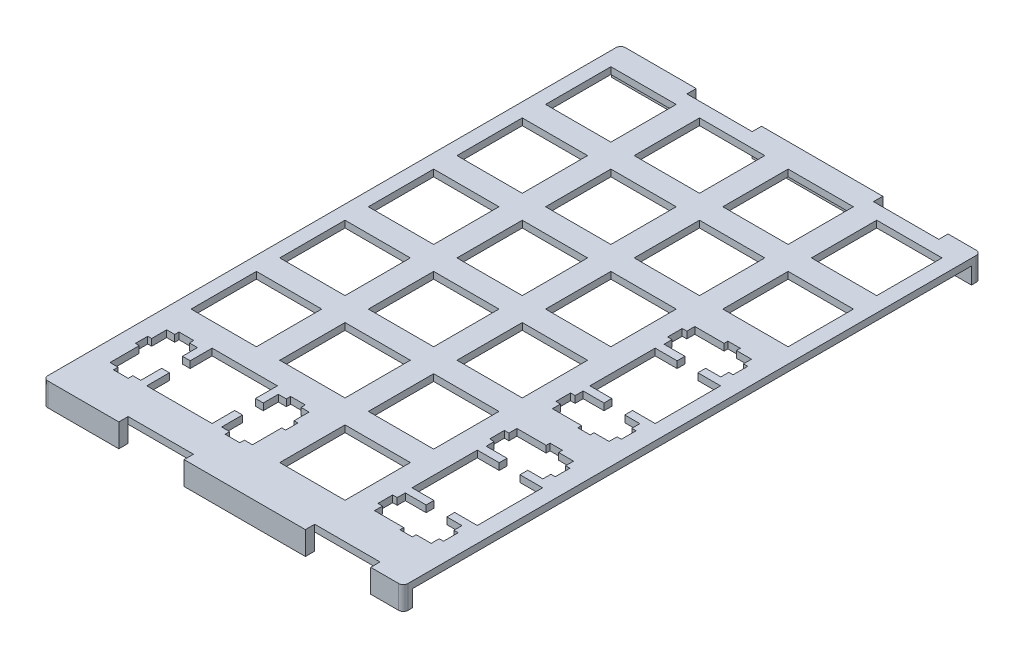
from build123d import *

# Parameters (mm, degrees)
SKETCH_1_W          = 14
SKETCH_1_H          = 14
EXTRUDE_1_DEPTH     = 1.45
SKETCH_2_W          = 16.2
SKETCH_2_H          = 2
SKETCH_2_W_2        = 26
SKETCH_2_W_3        = 7
EXTRUDE_2_DEPTH     = 3.55
FILLET_1_R          = 1
CUT_EXTRUDE_1_DEPTH = 164.601986541


with BuildPart() as part:
    # 草图1 → 凸台-拉伸1 (new body)
    with BuildSketch(Plane(origin=(0, 0, 0), x_dir=(1, 0, 0), z_dir=(0, 1, 0))):
        Polygon((109, 1.9), (109, -121.9), (102, -121.9), (102, -119.9), (88, -119.9), (88, -121.9), (62, -121.9), (62, -119.9), (48, -119.9), (48, -121.9), (31.8, -121.9), (31.8, 1.9), (48, 1.9), (48, -0.1), (62, -0.1), (62, 1.9), (88, 1.9), (88, -0.1), (102, -0.1), (102, 1.9), align=None)
        with Locations((41.8, -10.2)):
            Rectangle(SKETCH_1_W, SKETCH_1_H, mode=Mode.SUBTRACT)
        with Locations((60.8, -10.2)):
            Rectangle(SKETCH_1_W, SKETCH_1_H, mode=Mode.SUBTRACT)
        with Locations((79.8, -10.2)):
            Rectangle(SKETCH_1_W, SKETCH_1_H, mode=Mode.SUBTRACT)
        with Locations((98.8, -10.2)):
            Rectangle(SKETCH_1_W, SKETCH_1_H, mode=Mode.SUBTRACT)
        with Locations((60.8, -29.2)):
            Rectangle(SKETCH_1_W, SKETCH_1_H, mode=Mode.SUBTRACT)
        with Locations((79.8, -29.2)):
            Rectangle(SKETCH_1_W, SKETCH_1_H, mode=Mode.SUBTRACT)
        with Locations((98.8, -29.2)):
            Rectangle(SKETCH_1_W, SKETCH_1_H, mode=Mode.SUBTRACT)
        with Locations((60.8, -48.2)):
            Rectangle(SKETCH_1_W, SKETCH_1_H, mode=Mode.SUBTRACT)
        with Locations((79.8, -48.2)):
            Rectangle(SKETCH_1_W, SKETCH_1_H, mode=Mode.SUBTRACT)
        with Locations((60.8, -67.2)):
            Rectangle(SKETCH_1_W, SKETCH_1_H, mode=Mode.SUBTRACT)
        with Locations((79.8, -67.2)):
            Rectangle(SKETCH_1_W, SKETCH_1_H, mode=Mode.SUBTRACT)
        with Locations((98.8, -57.7)):
            Rectangle(SKETCH_1_W, SKETCH_1_H, mode=Mode.SUBTRACT)
        with Locations((60.8, -86.2)):
            Rectangle(SKETCH_1_W, SKETCH_1_H, mode=Mode.SUBTRACT)
        with Locations((79.8, -86.2)):
            Rectangle(SKETCH_1_W, SKETCH_1_H, mode=Mode.SUBTRACT)
        with Locations((79.8, -105.2)):
            Rectangle(SKETCH_1_W, SKETCH_1_H, mode=Mode.SUBTRACT)
        with Locations((41.8, -29.2)):
            Rectangle(SKETCH_1_W, SKETCH_1_H, mode=Mode.SUBTRACT)
        with Locations((41.8, -48.2)):
            Rectangle(SKETCH_1_W, SKETCH_1_H, mode=Mode.SUBTRACT)
        with Locations((41.8, -67.2)):
            Rectangle(SKETCH_1_W, SKETCH_1_H, mode=Mode.SUBTRACT)
        with Locations((41.8, -86.2)):
            Rectangle(SKETCH_1_W, SKETCH_1_H, mode=Mode.SUBTRACT)
        with Locations((98.662, -95.7)):
            Rectangle(SKETCH_1_W, SKETCH_1_H, mode=Mode.SUBTRACT)
        with Locations((51.3, -105.2)):
            Rectangle(SKETCH_1_W, SKETCH_1_H, mode=Mode.SUBTRACT)
    extrude(amount=EXTRUDE_1_DEPTH)

    # 草图2 → 凸台-拉伸2 (add)
    with BuildSketch(Plane.XZ):
        with Locations((39.9, -0.9)):
            Rectangle(SKETCH_2_W, SKETCH_2_H)
        with Locations((75, -0.9)):
            Rectangle(SKETCH_2_W_2, SKETCH_2_H)
        with Locations((105.5, -0.9)):
            Rectangle(SKETCH_2_W_3, SKETCH_2_H)
        with Locations((39.9, 120.9)):
            Rectangle(SKETCH_2_W, SKETCH_2_H)
        with Locations((75, 120.9)):
            Rectangle(SKETCH_2_W_2, SKETCH_2_H)
        with Locations((105.5, 120.9)):
            Rectangle(SKETCH_2_W_3, SKETCH_2_H)
    extrude(amount=EXTRUDE_2_DEPTH)

    # 圆角1
    fillet_1_edges = [part.edges().sort_by_distance(p)[0] for p in [
        (109, -1.05, -1.9),
        (109, -1.05, 121.9),
        (31.8, -1.05, 121.9),
        (31.8, -1.05, -1.9),
    ]]
    fillet(fillet_1_edges, radius=FILLET_1_R)

    # 草图5 → 切除-拉伸1 (cut, through all)
    with BuildSketch(Plane(origin=(0, 1.45, 0), x_dir=(1, 0, 0), z_dir=(0, 1, 0))):
        Polygon((92.03, -42.43), (98.3, -42.43), (98.3, -41.605), (100.95, -41.605), (100.95, -42.43), (104.18, -42.43), (104.18, -44.15), (105.1, -44.15), (105.1, -47.3), (104.18, -47.3), (104.18, -49.03), (100.95, -49.03), (100.95, -50.7), (96.5, -50.7), (96.5, -49.03), (92.03, -49.03), (92.03, -47.3), (91.05, -47.3), (91.05, -44.15), (92.03, -44.15), align=None)
        Polygon((92.03, -66.37), (96.5, -66.37), (96.5, -64.7), (100.95, -64.7), (100.95, -66.37), (104.18, -66.37), (104.18, -68.1), (105.1, -68.1), (105.1, -71.25), (104.18, -71.25), (104.18, -72.97), (100.95, -72.97), (100.95, -73.79), (98.3, -73.79), (98.3, -72.97), (92.03, -72.97), (92.03, -71.25), (91.05, -71.25), (91.05, -68.1), (92.03, -68.1), align=None)
        Polygon((91.892, -80.43), (98.162, -80.43), (98.162, -79.61), (100.812, -79.61), (100.812, -80.43), (104.042, -80.43), (104.042, -82.15), (104.962, -82.15), (104.962, -85.3), (104.042, -85.3), (104.042, -87.03), (100.812, -87.03), (100.812, -88.7), (96.362, -88.7), (96.362, -87.03), (91.892, -87.03), (91.892, -85.3), (90.912, -85.3), (90.912, -82.15), (91.892, -82.15), align=None)
        Polygon((91.892, -104.37), (96.362, -104.37), (96.362, -102.7), (100.812, -102.7), (100.812, -104.37), (104.042, -104.37), (104.042, -106.1), (104.962, -106.1), (104.962, -109.25), (104.042, -109.25), (104.042, -110.97), (100.812, -110.97), (100.812, -111.79), (98.162, -111.79), (98.162, -110.97), (91.892, -110.97), (91.892, -109.25), (90.912, -109.25), (90.912, -106.1), (91.892, -106.1), align=None)
        Polygon((59.97, -99.67), (61.69, -99.67), (61.69, -98.75), (64.84, -98.75), (64.84, -99.67), (66.57, -99.67), (66.57, -102.9), (67.4, -102.9), (67.4, -105.55), (66.57, -105.55), (66.57, -111.82), (64.84, -111.82), (64.84, -112.8), (61.69, -112.8), (61.69, -111.82), (59.97, -111.82), (59.97, -107.35), (58.3, -107.35), (58.3, -102.9), (59.97, -102.9), align=None)
        Polygon((36.03, -99.67), (37.76, -99.67), (37.76, -98.75), (40.91, -98.75), (40.91, -99.67), (42.63, -99.67), (42.63, -102.9), (44.3, -102.9), (44.3, -107.35), (42.63, -107.35), (42.63, -111.82), (40.91, -111.82), (40.91, -112.8), (37.76, -112.8), (37.76, -111.82), (36.03, -111.82), (36.03, -105.55), (35.2, -105.55), (35.2, -102.9), (36.03, -102.9), align=None)
    extrude(amount=-CUT_EXTRUDE_1_DEPTH, mode=Mode.SUBTRACT)


solid = part.part
